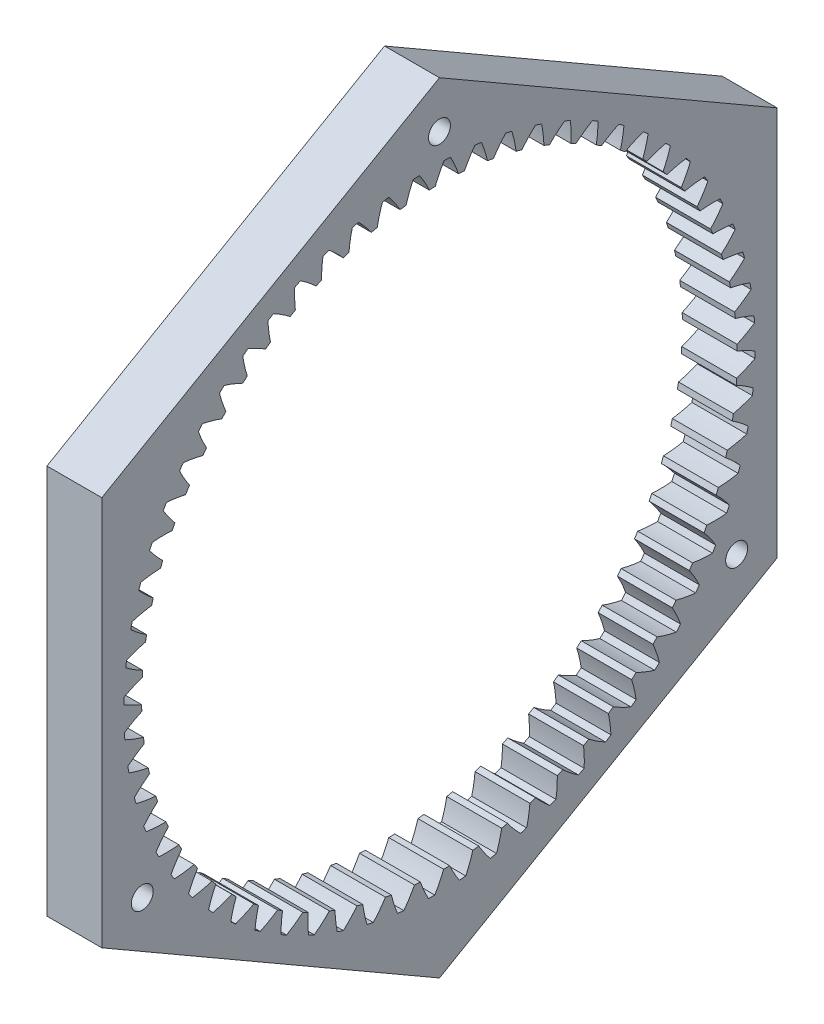
from build123d import *

# Parameters (mm, degrees)
SKETCH1_R           = 61.49
BOSS_EXTRUDE1_DEPTH = 10
BOSS_EXTRUDE2_DEPTH = 10
SKETCH3_R           = 2
CUT_EXTRUDE1_DEPTH  = 104.338520257


with BuildPart() as part:
    # Sketch1 → Boss-Extrude1 (new body)
    with BuildSketch(Plane(origin=(-234.217219259, 0, 0), x_dir=(0, 0, -1), z_dir=(1, 0, 0))):
        with Locations(Location((8.121494769, -4.714632127, 0), (0, 0, 180))):
            Circle(SKETCH1_R)
        with BuildLine():
            ThreePointArc((-39.348360131, -30.956997701), (-41.163118899, -31.085343009), (-42.982352249, -31.070785487))
            ThreePointArc((-42.982352249, -31.070785487), (-43.248233902, -30.548737033), (-43.508782772, -30.024006694))
            ThreePointArc((-43.508782772, -30.024006694), (-42.435698244, -28.554887401), (-41.250562689, -27.174570183))
            ThreePointArc((-41.250562689, -27.174570183), (-41.473776402, -26.677281162), (-41.691981434, -26.177774109))
            ThreePointArc((-41.691981434, -26.177774109), (-43.510581682, -26.127623935), (-45.31962804, -25.93482046))
            ThreePointArc((-45.31962804, -25.93482046), (-45.533059703, -25.389224852), (-45.740921393, -24.841482979))
            ThreePointArc((-45.740921393, -24.841482979), (-44.529005187, -23.484618573), (-43.214281638, -22.227111558))
            ThreePointArc((-43.214281638, -22.227111558), (-43.387677668, -21.71033835), (-43.55587173, -21.191848726))
            ThreePointArc((-43.55587173, -21.191848726), (-45.360799345, -20.963686043), (-47.142236605, -20.594493419))
            ThreePointArc((-47.142236605, -20.594493419), (-47.301162815, -20.030605043), (-47.454335501, -19.465126688))
            ThreePointArc((-47.454335501, -19.465126688), (-46.115259035, -18.233584516), (-44.683608997, -17.110998183))
            ThreePointArc((-44.683608997, -17.110998183), (-44.805517445, -16.579717596), (-44.922080737, -16.047238741))
            ThreePointArc((-44.922080737, -16.047238741), (-46.695953278, -15.64326088), (-48.432625226, -15.101234634))
            ThreePointArc((-48.432625226, -15.101234634), (-48.535515437, -14.524484041), (-48.632523983, -13.94671507))
            ThreePointArc((-48.632523983, -13.94671507), (-47.179183294, -12.852355556), (-45.644394341, -11.875501026))
            ThreePointArc((-45.644394341, -11.875501026), (-45.713641163, -11.334829583), (-45.777451116, -10.793489558))
            ThreePointArc((-45.777451116, -10.793489558), (-47.503185221, -10.217587048), (-49.178366756, -9.507947188))
            ThreePointArc((-49.178366756, -9.507947188), (-49.224230078, -8.923888803), (-49.26414024, -8.339393447))
            ThreePointArc((-49.26414024, -8.339393447), (-47.710531793, -7.392755871), (-46.087384781, -6.571040788))
            ThreePointArc((-46.087384781, -6.571040788), (-46.103303092, -6.026185449), (-46.113745181, -5.481197656))
            ThreePointArc((-46.113745181, -5.481197656), (-47.774721088, -4.738916751), (-49.372279296, -3.868497498))
            ThreePointArc((-49.372279296, -3.868497498), (-49.360674041, -3.282756122), (-49.343101461, -2.697163391))
            ThreePointArc((-49.343101461, -2.697163391), (-47.704187356, -1.907364391), (-46.008314077, -1.248702319))
            ThreePointArc((-46.008314077, -1.248702319), (-45.970750575, -0.70491034), (-45.927724238, -0.161523308))
            ThreePointArc((-45.927724238, -0.161523308), (-47.50794584, 0.739987419), (-49.012495362, 1.762803453))
            ThreePointArc((-49.012495362, 1.762803453), (-48.943533295, 2.344586811), (-48.868647208, 2.925637338))
            ThreePointArc((-48.868647208, 2.925637338), (-47.160211082, 3.550991566), (-45.407943724, 4.040257352))
            ThreePointArc((-45.407943724, 4.040257352), (-45.317260166, 4.577748956), (-45.221179769, 5.114302112))
            ThreePointArc((-45.221179769, 5.114302112), (-46.705428669, 6.166360622), (-48.102479871, 7.331723159))
            ThreePointArc((-48.102479871, 7.331723159), (-47.976825135, 7.903945606), (-47.845346733, 8.474858096))
            ThreePointArc((-47.845346733, 8.474858096), (-46.083841761, 8.929745049), (-44.292055616, 9.24490265))
            ThreePointArc((-44.292055616, 9.24490265), (-44.149125334, 9.770917543), (-44.000916184, 10.295469523))
            ThreePointArc((-44.000916184, 10.295469523), (-45.374898254, 11.487943916), (-46.650996769, 12.784629878))
            ThreePointArc((-46.650996769, 12.784629878), (-46.469859487, 13.341780599), (-46.283054979, 13.897056853))
            ThreePointArc((-46.283054979, 13.897056853), (-44.485445418, 14.177095721), (-42.671396365, 14.315109998))
            ThreePointArc((-42.671396365, 14.315109998), (-42.477595856, 14.824582367), (-42.278685289, 15.33208145))
            ThreePointArc((-42.278685289, 15.33208145), (-43.529168329, 16.653487546), (-44.672024632, 18.069009137))
            ThreePointArc((-44.672024632, 18.069009137), (-44.437149255, 18.605722468), (-44.196817672, 19.140014871))
            ThreePointArc((-44.196817672, 19.140014871), (-42.380415482, 19.242508726), (-40.561573807, 19.202050527))
            ThreePointArc((-40.561573807, 19.202050527), (-40.318769476, 19.690073875), (-40.071073109, 20.175632566))
            ThreePointArc((-40.071073109, 20.175632566), (-41.186014285, 21.613244502), (-42.184622043, 23.133969477))
            ThreePointArc((-42.184622043, 23.133969477), (-41.898270549, 23.645076573), (-41.606726415, 24.153239598))
            ThreePointArc((-41.606726415, 24.153239598), (-39.855877021, 23.956940695), (-38.125026405, 23.62805925))
            ThreePointArc((-38.125026405, 23.62805925), (-37.765794886, 24.20604427), (-37.399340155, 24.779476827))
            ThreePointArc((-37.399340155, 24.779476827), (-38.368001973, 26.319449614), (-39.212744049, 27.930732559))
            ThreePointArc((-39.212744049, 27.930732559), (-38.87767416, 28.41131118), (-38.537725204, 28.888450939))
            ThreePointArc((-38.537725204, 28.888450939), (-36.736229114, 28.634612916), (-34.960228975, 28.240093701))
            ThreePointArc((-34.960228975, 28.240093701), (-34.626881428, 28.671371043), (-34.289216676, 29.099276695))
            ThreePointArc((-34.289216676, 29.099276695), (-35.102270395, 30.726779554), (-35.78501146, 32.413102934))
            ThreePointArc((-35.78501146, 32.413102934), (-35.404450082, 32.858524845), (-35.019370198, 33.300046221))
            ThreePointArc((-35.019370198, 33.300046221), (-33.251429281, 32.870853002), (-31.522650714, 32.304155051))
            ThreePointArc((-31.522650714, 32.304155051), (-31.148635755, 32.700681901), (-30.770654863, 33.093430137))
            ThreePointArc((-30.770654863, 33.093430137), (-31.420270329, 34.792789325), (-31.934435214, 36.537912924))
            ThreePointArc((-31.934435214, 36.537912924), (-31.512047361, 36.943888469), (-31.08554508, 37.34553937))
            ThreePointArc((-31.08554508, 37.34553937), (-29.368185573, 36.745124321), (-27.70327766, 36.011705243))
            ThreePointArc((-27.70327766, 36.011705243), (-27.292197257, 36.369662831), (-26.877540387, 36.723471272))
            ThreePointArc((-26.877540387, 36.723471272), (-27.357461449, 38.478321031), (-27.698098466, 40.265438355))
            ThreePointArc((-27.698098466, 40.265438355), (-27.237951963, 40.628057767), (-26.774134734, 40.985970075))
            ThreePointArc((-26.774134734, 40.985970075), (-25.12389575, 40.22011552), (-23.538892464, 39.327038543))
            ThreePointArc((-23.538892464, 39.327038543), (-23.094705546, 39.642979542), (-22.647366071, 39.954440818))
            ThreePointArc((-22.647366071, 39.954440818), (-22.952970827, 41.747880986), (-23.116799453, 43.559781117))
            ThreePointArc((-23.116799453, 43.559781117), (-22.623325764, 43.875552174), (-22.126660401, 44.186278998))
            ThreePointArc((-22.126660401, 44.186278998), (-20.559434642, 43.262360536), (-19.069600431, 42.21822648))
            ThreePointArc((-19.069600431, 42.21822648), (-18.596584762, 42.489108205), (-18.120870805, 42.755222773))
            ThreePointArc((-18.120870805, 42.755222773), (-18.249216114, 44.569981541), (-18.234658591, 46.389214891))
            ThreePointArc((-18.234658591, 46.389214891), (-17.712610137, 46.655096544), (-17.187879799, 46.915645415))
            ThreePointArc((-17.187879799, 46.915645415), (-15.718760505, 45.842560886), (-14.338443287, 44.657425331))
            ThreePointArc((-14.338443287, 44.657425331), (-13.841154266, 44.880639044), (-13.341647213, 45.098844076))
            ThreePointArc((-13.341647213, 45.098844076), (-13.291497039, 46.917444325), (-13.098693564, 48.726490682))
            ThreePointArc((-13.098693564, 48.726490682), (-12.553097957, 48.939922346), (-12.005356083, 49.147784035))
            ThreePointArc((-12.005356083, 49.147784035), (-10.648491678, 47.93586783), (-9.390984663, 46.62114428))
            ThreePointArc((-9.390984663, 46.62114428), (-8.874211454, 46.79454031), (-8.35572183, 46.962734372))
            ThreePointArc((-8.35572183, 46.962734372), (-8.127559148, 48.767661987), (-7.758366524, 50.549099247))
            ThreePointArc((-7.758366524, 50.549099247), (-7.194478147, 50.708025457), (-6.628999792, 50.861198143))
            ThreePointArc((-6.628999792, 50.861198143), (-5.39745762, 49.522121677), (-4.274871287, 48.090471639))
            ThreePointArc((-4.274871287, 48.090471639), (-3.7435907, 48.212380088), (-3.211111845, 48.328943379))
            ThreePointArc((-3.211111845, 48.328943379), (-2.807133984, 50.102815921), (-2.265107738, 51.839487868))
            ThreePointArc((-2.265107738, 51.839487868), (-1.688357145, 51.942378079), (-1.110588174, 52.039386625))
            ThreePointArc((-1.110588174, 52.039386625), (-0.01622866, 50.586045936), (0.960625869, 49.051256983))
            ThreePointArc((0.960625869, 49.051256983), (1.501297313, 49.120503805), (2.042637338, 49.184313758))
            ThreePointArc((2.042637338, 49.184313758), (2.618539848, 50.910047863), (3.328179708, 52.585229398))
            ThreePointArc((3.328179708, 52.585229398), (3.912238093, 52.63109272), (4.496733449, 52.671002882))
            ThreePointArc((4.496733449, 52.671002882), (5.443371024, 51.117394436), (6.265086108, 49.494247423))
            ThreePointArc((6.265086108, 49.494247423), (6.809941446, 49.510165734), (7.35492924, 49.520607823))
            ThreePointArc((7.35492924, 49.520607823), (8.097210144, 51.18158373), (8.967629398, 52.779141938))
            ThreePointArc((8.967629398, 52.779141938), (9.553370774, 52.767536683), (10.138963505, 52.749964103))
            ThreePointArc((10.138963505, 52.749964103), (10.928762505, 51.111049998), (11.587424577, 49.415176719))
            ThreePointArc((11.587424577, 49.415176719), (12.131216555, 49.377613217), (12.674603588, 49.33458688))
            ThreePointArc((12.674603588, 49.33458688), (13.576114315, 50.914808482), (14.598930349, 52.419358004))
            ThreePointArc((14.598930349, 52.419358004), (15.180713707, 52.350395938), (15.761764234, 52.27550985))
            ThreePointArc((15.761764234, 52.27550985), (16.387118462, 50.567073724), (16.876384247, 48.814806366))
            ThreePointArc((16.876384247, 48.814806366), (17.413875852, 48.724122808), (17.950429008, 48.628042411))
            ThreePointArc((17.950429008, 48.628042411), (19.002487518, 50.112291311), (20.167850054, 51.509342513))
            ThreePointArc((20.167850054, 51.509342513), (20.740072502, 51.383687777), (21.310984992, 51.252209375))
            ThreePointArc((21.310984992, 51.252209375), (21.765871945, 49.490704403), (22.081029546, 47.698918258))
            ThreePointArc((22.081029546, 47.698918258), (22.607044438, 47.555987976), (23.131596419, 47.407778827))
            ThreePointArc((23.131596419, 47.407778827), (24.324070812, 48.781760896), (25.620756773, 50.057859411))
            ThreePointArc((25.620756773, 50.057859411), (26.177907495, 49.876722129), (26.733183749, 49.689917622))
            ThreePointArc((26.733183749, 49.689917622), (27.013222617, 47.89230806), (27.151236894, 46.078259008))
            ThreePointArc((27.151236894, 46.078259008), (27.660709263, 45.884458498), (28.168208346, 45.685547932))
            ThreePointArc((28.168208346, 45.685547932), (29.489614442, 46.936030972), (30.905136033, 48.078887274))
            ThreePointArc((30.905136033, 48.078887274), (31.441849363, 47.844011897), (31.976141766, 47.603680314))
            ThreePointArc((31.976141766, 47.603680314), (32.078635622, 45.787278124), (32.038177422, 43.968436449))
            ThreePointArc((32.038177422, 43.968436449), (32.526200771, 43.725632118), (33.011759462, 43.477935751))
            ThreePointArc((33.011759462, 43.477935751), (34.449371398, 44.592876927), (35.970096373, 45.591484685))
            ThreePointArc((35.970096373, 45.591484685), (36.481203469, 45.305133191), (36.989366493, 45.013589057))
            ThreePointArc((36.989366493, 45.013589057), (36.913328264, 43.195887186), (36.694787223, 41.389769328))
            ThreePointArc((36.694787223, 41.389769328), (37.156661619, 41.100299513), (37.615603723, 40.806202797))
            ThreePointArc((37.615603723, 40.806202797), (39.15557651, 41.774864615), (40.766859455, 42.619606692))
            ThreePointArc((40.766859455, 42.619606692), (41.247438076, 42.284536802), (41.724577835, 41.944587846))
            ThreePointArc((41.724577835, 41.944587846), (41.470739811, 40.143091756), (41.076220597, 38.367091617))
            ThreePointArc((41.076220597, 38.367091617), (41.507497938, 38.033744071), (41.935403591, 37.696079319))
            ThreePointArc((41.935403591, 37.696079319), (43.56290645, 38.509133037), (45.24922983, 39.191874102))
            ThreePointArc((45.24922983, 39.191874102), (45.694651741, 38.811312724), (46.136173117, 38.42623284))
            ThreePointArc((46.136173117, 38.42623284), (45.706979898, 36.658291924), (45.140281946, 34.929513356))
            ThreePointArc((45.140281946, 34.929513356), (45.536808796, 34.555498397), (45.929557033, 34.177517505))
            ThreePointArc((45.929557033, 34.177517505), (47.628916221, 34.827132971), (49.37403982, 35.341297856))
            ThreePointArc((49.37403982, 35.341297856), (49.780015365, 34.918910003), (50.181666266, 34.492407722))
            ThreePointArc((50.181666266, 34.492407722), (49.581251216, 32.775048216), (48.847832139, 31.110140302))
            ThreePointArc((48.847832139, 31.110140302), (49.205789727, 30.6990599), (49.559598167, 30.28440303))
            ThreePointArc((49.559598167, 30.28440303), (51.314447927, 30.764324092), (53.10156525, 31.104961108))
            ThreePointArc((53.10156525, 31.104961108), (53.464184663, 30.644814606), (53.82209697, 30.180997377))
            ThreePointArc((53.82209697, 30.180997377), (53.056242416, 28.530758392), (52.163165439, 26.945755106))
            ThreePointArc((52.163165439, 26.945755106), (52.479106438, 26.501568189), (52.790567714, 26.054228713))
            ThreePointArc((52.790567714, 26.054228713), (54.584007882, 26.359833469), (56.395908013, 26.523662096))
            ThreePointArc((56.395908013, 26.523662096), (56.71167907, 26.030188407), (57.022405893, 25.533523044))
            ThreePointArc((57.022405893, 25.533523044), (56.098487432, 23.966297284), (55.054353375, 22.476463073))
            ThreePointArc((55.054353375, 22.476463073), (55.325235101, 22.003447404), (55.591349669, 21.527733447))
            ThreePointArc((55.591349669, 21.527733447), (57.406108437, 21.656078756), (59.225341787, 21.641521233))
            ThreePointArc((59.225341787, 21.641521233), (59.49122344, 21.119472779), (59.75177231, 20.594742441))
            ThreePointArc((59.75177231, 20.594742441), (58.678687782, 19.125623147), (57.493552227, 17.74530593))
            ThreePointArc((57.493552227, 17.74530593), (57.71676594, 17.248016908), (57.934970972, 16.748509855))
            ThreePointArc((57.934970972, 16.748509855), (59.75357122, 16.698359681), (61.562617578, 16.505556206))
            ThreePointArc((61.562617578, 16.505556206), (61.776049241, 15.959960599), (61.983910931, 15.412218725))
            ThreePointArc((61.983910931, 15.412218725), (60.771994725, 14.05535432), (59.457271176, 12.797847305))
            ThreePointArc((59.457271176, 12.797847305), (59.630667206, 12.281074096), (59.798861268, 11.762584473))
            ThreePointArc((59.798861268, 11.762584473), (61.603788883, 11.53442179), (63.385226143, 11.165229166))
            ThreePointArc((63.385226143, 11.165229166), (63.544152353, 10.601340789), (63.697325039, 10.035862434))
            ThreePointArc((63.697325039, 10.035862434), (62.358248573, 8.804320262), (60.926598535, 7.68173393))
            ThreePointArc((60.926598535, 7.68173393), (61.048506983, 7.150453342), (61.165070275, 6.617974487))
            ThreePointArc((61.165070275, 6.617974487), (62.938942816, 6.213996627), (64.675614764, 5.67197038))
            ThreePointArc((64.675614764, 5.67197038), (64.778504974, 5.095219787), (64.875513521, 4.517450816))
            ThreePointArc((64.875513521, 4.517450816), (63.422172832, 3.423091303), (61.887383878, 2.446236773))
            ThreePointArc((61.887383878, 2.446236773), (61.956630701, 1.905565329), (62.020440653, 1.364225305))
            ThreePointArc((62.020440653, 1.364225305), (63.746174759, 0.788322794), (65.421356293, 0.078682934))
            ThreePointArc((65.421356293, 0.078682934), (65.467219616, -0.505375451), (65.507129778, -1.089870807))
            ThreePointArc((65.507129778, -1.089870807), (63.953521331, -2.036508382), (62.330374319, -2.858223466))
            ThreePointArc((62.330374319, -2.858223466), (62.346292629, -3.403078804), (62.356734719, -3.948066598))
            ThreePointArc((62.356734719, -3.948066598), (64.017710626, -4.690347502), (65.615268834, -5.560766756))
            ThreePointArc((65.615268834, -5.560766756), (65.603663579, -6.146508132), (65.586090999, -6.732100863))
            ThreePointArc((65.586090999, -6.732100863), (63.947176894, -7.521899862), (62.251303615, -8.180561935))
            ThreePointArc((62.251303615, -8.180561935), (62.213740113, -8.724353913), (62.170713776, -9.267740945))
            ThreePointArc((62.170713776, -9.267740945), (63.750935378, -10.169251673), (65.2554849, -11.192067707))
            ThreePointArc((65.2554849, -11.192067707), (65.186522833, -11.773851064), (65.111636745, -12.354901592))
            ThreePointArc((65.111636745, -12.354901592), (63.40320062, -12.98025582), (61.650933262, -13.469521605))
            ThreePointArc((61.650933262, -13.469521605), (61.560249703, -14.007013209), (61.464169307, -14.543566366))
            ThreePointArc((61.464169307, -14.543566366), (62.948418207, -15.595624875), (64.345469409, -16.760987412))
            ThreePointArc((64.345469409, -16.760987412), (64.219814673, -17.333209859), (64.088336271, -17.90412235))
            ThreePointArc((64.088336271, -17.90412235), (62.326831299, -18.359009303), (60.535045154, -18.674166904))
            ThreePointArc((60.535045154, -18.674166904), (60.392114872, -19.200181796), (60.243905722, -19.724733777))
            ThreePointArc((60.243905722, -19.724733777), (61.617887792, -20.91720817), (62.893986307, -22.213894131))
            ThreePointArc((62.893986307, -22.213894131), (62.712849025, -22.771044853), (62.526044517, -23.326321107))
            ThreePointArc((62.526044517, -23.326321107), (60.728434955, -23.606359974), (58.914385903, -23.744374252))
            ThreePointArc((58.914385903, -23.744374252), (58.720585394, -24.253846621), (58.521674827, -24.761345703))
            ThreePointArc((58.521674827, -24.761345703), (59.772157867, -26.082751799), (60.91501417, -27.498273391))
            ThreePointArc((60.91501417, -27.498273391), (60.680138793, -28.034986721), (60.43980721, -28.569279124))
            ThreePointArc((60.43980721, -28.569279124), (58.62340502, -28.67177298), (56.804563345, -28.63131478))
            ThreePointArc((56.804563345, -28.63131478), (56.561759014, -29.119338129), (56.314062647, -29.60489682))
            ThreePointArc((56.314062647, -29.60489682), (57.429003822, -31.042508756), (58.427611581, -32.56323373))
            ThreePointArc((58.427611581, -32.56323373), (58.141260087, -33.074340826), (57.849715953, -33.582503851))
            ThreePointArc((57.849715953, -33.582503851), (56.032014082, -33.506465622), (54.225896224, -33.28792458))
            ThreePointArc((54.225896224, -33.28792458), (53.936426408, -33.749798977), (53.642329693, -34.20874108))
            ThreePointArc((53.642329693, -34.20874108), (54.610991511, -35.748713868), (55.455733587, -37.359996813))
            ThreePointArc((55.455733587, -37.359996813), (55.120663698, -37.840575434), (54.780714742, -38.317715192))
            ThreePointArc((54.780714742, -38.317715192), (52.979218652, -38.063877169), (51.203218513, -37.669357954))
            ThreePointArc((51.203218513, -37.669357954), (50.869870966, -38.100635296), (50.532206214, -38.528540949))
            ThreePointArc((50.532206214, -38.528540949), (51.345259932, -40.156043808), (52.028000998, -41.842367188))
            ThreePointArc((52.028000998, -41.842367188), (51.64743962, -42.287789099), (51.262359736, -42.729310475))
            ThreePointArc((51.262359736, -42.729310475), (49.494418819, -42.300117256), (47.765640252, -41.733419304))
            ThreePointArc((47.765640252, -41.733419304), (47.391625293, -42.129946154), (47.013644401, -42.522694391))
            ThreePointArc((47.013644401, -42.522694391), (47.663259867, -44.222053579), (48.177424752, -45.967177178))
            ThreePointArc((48.177424752, -45.967177178), (47.755036899, -46.373152723), (47.328534617, -46.774803623))
            ThreePointArc((47.328534617, -46.774803623), (45.611175111, -46.174388574), (43.946267198, -45.440969497))
            ThreePointArc((43.946267198, -45.440969497), (43.535186795, -45.798927085), (43.120529925, -46.152735525))
            ThreePointArc((43.120529925, -46.152735525), (43.600450987, -47.907585285), (43.941088004, -49.694702608))
            ThreePointArc((43.941088004, -49.694702608), (43.480941501, -50.05732202), (43.017124272, -50.415234328))
            ThreePointArc((43.017124272, -50.415234328), (41.366885288, -49.649379774), (39.781882002, -48.756302797))
            ThreePointArc((39.781882002, -48.756302797), (39.337695084, -49.072243796), (38.890355609, -49.383705071))
            ThreePointArc((38.890355609, -49.383705071), (39.195960365, -51.17714524), (39.359788991, -52.989045371))
            ThreePointArc((39.359788991, -52.989045371), (38.866315302, -53.304816427), (38.369649939, -53.615543251))
            ThreePointArc((38.369649939, -53.615543251), (36.80242418, -52.69162479), (35.312589969, -51.647490733))
            ThreePointArc((35.312589969, -51.647490733), (34.8395743, -51.918372459), (34.363860343, -52.184487027))
            ThreePointArc((34.363860343, -52.184487027), (34.492205652, -53.999245795), (34.477648129, -55.818479145))
            ThreePointArc((34.477648129, -55.818479145), (33.955599675, -56.084360798), (33.430869337, -56.344909668))
            ThreePointArc((33.430869337, -56.344909668), (31.961750043, -55.271825139), (30.581432825, -54.086689585))
            ThreePointArc((30.581432825, -54.086689585), (30.084143804, -54.309903297), (29.584636751, -54.52810833))
            ThreePointArc((29.584636751, -54.52810833), (29.534486577, -56.346708578), (29.341683102, -58.155754936))
            ThreePointArc((29.341683102, -58.155754936), (28.796087495, -58.369186599), (28.248345621, -58.577048288))
            ThreePointArc((28.248345621, -58.577048288), (26.891481215, -57.365132083), (25.6339742, -56.050408534))
            ThreePointArc((25.6339742, -56.050408534), (25.117200992, -56.223804564), (24.598711368, -56.391998626))
            ThreePointArc((24.598711368, -56.391998626), (24.370548686, -58.196926241), (24.001356062, -59.9783635))
            ThreePointArc((24.001356062, -59.9783635), (23.437467685, -60.137289711), (22.87198933, -60.290462397))
            ThreePointArc((22.87198933, -60.290462397), (21.640447158, -58.95138593), (20.517860825, -57.519735893))
            ThreePointArc((20.517860825, -57.519735893), (19.986580238, -57.641644341), (19.454101383, -57.758207633))
            ThreePointArc((19.454101383, -57.758207633), (19.050123522, -59.532080174), (18.508097276, -61.268752121))
            ThreePointArc((18.508097276, -61.268752121), (17.931346683, -61.371642332), (17.353577712, -61.468650879))
            ThreePointArc((17.353577712, -61.468650879), (16.259218198, -60.01531019), (15.282363669, -58.480521236))
            ThreePointArc((15.282363669, -58.480521236), (14.741692225, -58.549768058), (14.2003522, -58.613578011))
            ThreePointArc((14.2003522, -58.613578011), (13.62444969, -60.339312117), (12.91480983, -62.014493651))
            ThreePointArc((12.91480983, -62.014493651), (12.330751445, -62.060356974), (11.746256089, -62.100267136))
            ThreePointArc((11.746256089, -62.100267136), (10.799618514, -60.546658689), (9.97790343, -58.923511676))
            ThreePointArc((9.97790343, -58.923511676), (9.433048091, -58.939429987), (8.888060298, -58.949872077))
            ThreePointArc((8.888060298, -58.949872077), (8.145779394, -60.610847984), (7.27536014, -62.208406191))
            ThreePointArc((7.27536014, -62.208406191), (6.689618764, -62.196800937), (6.104026033, -62.179228357))
            ThreePointArc((6.104026033, -62.179228357), (5.314227033, -60.540314252), (4.655564961, -58.844440973))
            ThreePointArc((4.655564961, -58.844440973), (4.111772983, -58.806877471), (3.56838595, -58.763851133))
            ThreePointArc((3.56838595, -58.763851133), (2.666875223, -60.344072736), (1.644059189, -61.848622258))
            ThreePointArc((1.644059189, -61.848622258), (1.062275831, -61.779660191), (0.481225304, -61.704774103))
            ThreePointArc((0.481225304, -61.704774103), (-0.144128924, -59.996337978), (-0.63339471, -58.24407062))
            ThreePointArc((-0.63339471, -58.24407062), (-1.170886314, -58.153387061), (-1.70743947, -58.057306665))
            ThreePointArc((-1.70743947, -58.057306665), (-2.75949798, -59.541555565), (-3.924860517, -60.938606767))
            ThreePointArc((-3.924860517, -60.938606767), (-4.497082964, -60.81295203), (-5.067995454, -60.681473628))
            ThreePointArc((-5.067995454, -60.681473628), (-5.522882407, -58.919968657), (-5.838040008, -57.128182512))
            ThreePointArc((-5.838040008, -57.128182512), (-6.3640549, -56.985252229), (-6.888606881, -56.83704308))
            ThreePointArc((-6.888606881, -56.83704308), (-8.081081274, -58.211025149), (-9.377767235, -59.487123665))
            ThreePointArc((-9.377767235, -59.487123665), (-9.934917957, -59.305986382), (-10.490194211, -59.119181875))
            ThreePointArc((-10.490194211, -59.119181875), (-10.770233079, -57.321572313), (-10.908247356, -55.507523261))
            ThreePointArc((-10.908247356, -55.507523261), (-11.417719725, -55.313722752), (-11.925218808, -55.114812185))
            ThreePointArc((-11.925218808, -55.114812185), (-13.246624904, -56.365295225), (-14.662146495, -57.508151528))
            ThreePointArc((-14.662146495, -57.508151528), (-15.198859825, -57.27327615), (-15.733152228, -57.032944567))
            ThreePointArc((-15.733152228, -57.032944567), (-15.835646084, -55.216542378), (-15.795187884, -53.397700703))
            ThreePointArc((-15.795187884, -53.397700703), (-16.283211233, -53.154896371), (-16.768769924, -52.907200005))
            ThreePointArc((-16.768769924, -52.907200005), (-18.20638186, -54.02214118), (-19.727106835, -55.020748939))
            ThreePointArc((-19.727106835, -55.020748939), (-20.238213931, -54.734397445), (-20.746376955, -54.442853311))
            ThreePointArc((-20.746376955, -54.442853311), (-20.670338727, -52.62515144), (-20.451797685, -50.819033581))
            ThreePointArc((-20.451797685, -50.819033581), (-20.913672081, -50.529563766), (-21.372614185, -50.235467051))
            ThreePointArc((-21.372614185, -50.235467051), (-22.912586972, -51.204128869), (-24.523869917, -52.048870945))
            ThreePointArc((-24.523869917, -52.048870945), (-25.004448538, -51.713801056), (-25.481588297, -51.3738521))
            ThreePointArc((-25.481588297, -51.3738521), (-25.227750273, -49.57235601), (-24.833231059, -47.796355871))
            ThreePointArc((-24.833231059, -47.796355871), (-25.2645084, -47.463008324), (-25.692414053, -47.125343572))
            ThreePointArc((-25.692414053, -47.125343572), (-27.319916912, -47.93839729), (-29.006240292, -48.621138356))
            ThreePointArc((-29.006240292, -48.621138356), (-29.451662203, -48.240576977), (-29.893183579, -47.855497094))
            ThreePointArc((-29.893183579, -47.855497094), (-29.46399036, -46.087556177), (-28.897292408, -44.35877761))
            ThreePointArc((-28.897292408, -44.35877761), (-29.293819258, -43.984762651), (-29.686567495, -43.606781758))
            ThreePointArc((-29.686567495, -43.606781758), (-31.385926683, -44.256397225), (-33.131050282, -44.77056211))
            ThreePointArc((-33.131050282, -44.77056211), (-33.537025827, -44.348174257), (-33.938676728, -43.921671975))
            ThreePointArc((-33.938676728, -43.921671975), (-33.338261678, -42.204312469), (-32.604842601, -40.539404556))
            ThreePointArc((-32.604842601, -40.539404556), (-32.962800189, -40.128324153), (-33.316608629, -39.713667283))
            ThreePointArc((-33.316608629, -39.713667283), (-35.071458389, -40.193588345), (-36.858575712, -40.534225361))
            ThreePointArc((-36.858575712, -40.534225361), (-37.221195125, -40.074078859), (-37.579107432, -39.61026163))
            ThreePointArc((-37.579107432, -39.61026163), (-36.813252878, -37.960022646), (-35.920175901, -36.375019359))
            ThreePointArc((-35.920175901, -36.375019359), (-36.2361169, -35.930832442), (-36.547578176, -35.483492967))
            ThreePointArc((-36.547578176, -35.483492967), (-38.341018344, -35.789097723), (-40.152918475, -35.952926349))
            ThreePointArc((-40.152918475, -35.952926349), (-40.468689532, -35.45945266), (-40.779416355, -34.962787297))
            ThreePointArc((-40.779416355, -34.962787297), (-39.855497894, -33.395561538), (-38.811363837, -31.905727327))
            ThreePointArc((-38.811363837, -31.905727327), (-39.082245563, -31.432711658), (-39.348360131, -30.956997701))
        make_face(mode=Mode.SUBTRACT)
    extrude(amount=-BOSS_EXTRUDE1_DEPTH)

    # Sketch2 → Boss-Extrude2 (add)
    with BuildSketch(Plane(origin=(-234.217219259, 0, 0), x_dir=(0, 0, -1), z_dir=(1, 0, 0))):
        with BuildLine():
            Line((69.611494769, 30.786635926), (38.866495443, 48.537269563))
            ThreePointArc((38.866495443, 48.537269563), (61.373397042, 26.030367536), (69.611494769, -4.714632127))
            Line((69.611494769, -4.714632127), (69.611494769, 30.786635926))
        make_face()
        with BuildLine():
            Line((38.866495443, 48.537269563), (8.121494769, 66.287903978))
            Line((8.121494769, 66.287903978), (-22.623505627, 48.537269724))
            ThreePointArc((-22.623505627, 48.537269724), (8.12149493, 56.775367873), (38.866495443, 48.537269563))
        make_face()
        with BuildLine():
            ThreePointArc((-53.368505231, -4.714632368), (-45.130407484, 26.030367571), (-22.623505627, 48.537269724))
            Line((-22.623505627, 48.537269724), (-53.368505231, 30.786635926))
            Line((-53.368505231, 30.786635926), (-53.368505231, -4.714632368))
        make_face()
        with BuildLine():
            ThreePointArc((-22.62350624, -57.966533623), (-45.130407541, -35.459631727), (-53.368505231, -4.714632368))
            Line((-53.368505231, -4.714632368), (-53.368505231, -40.215900179))
            Line((-53.368505231, -40.215900179), (-22.62350624, -57.966533623))
        make_face()
        with BuildLine():
            ThreePointArc((38.866495443, -57.966533817), (8.121494575, -66.204632127), (-22.62350624, -57.966533623))
            Line((-22.62350624, -57.966533623), (8.121494769, -75.717168232))
            Line((8.121494769, -75.717168232), (38.866495443, -57.966533817))
        make_face()
        with BuildLine():
            Line((69.611494769, -40.215900179), (69.611494769, -4.714632127))
            ThreePointArc((69.611494769, -4.714632127), (61.373397042, -35.45963179), (38.866495443, -57.966533817))
            Line((38.866495443, -57.966533817), (69.611494769, -40.215900179))
        make_face()
    extrude(amount=-BOSS_EXTRUDE2_DEPTH)

    # Sketch3 → Cut-Extrude1 (cut, through all)
    with BuildSketch(Plane(origin=(-234.217219259, 0, 0), x_dir=(0, 0, -1), z_dir=(1, 0, 0))):
        with Locations((8.121494769, 57.785367873)):
            Circle(SKETCH3_R)
        with Locations((62.248082505, -35.964632127)):
            Circle(SKETCH3_R)
        with Locations((-46.005092968, -35.964632127)):
            Circle(SKETCH3_R)
    extrude(amount=-CUT_EXTRUDE1_DEPTH, mode=Mode.SUBTRACT)


solid = part.part
